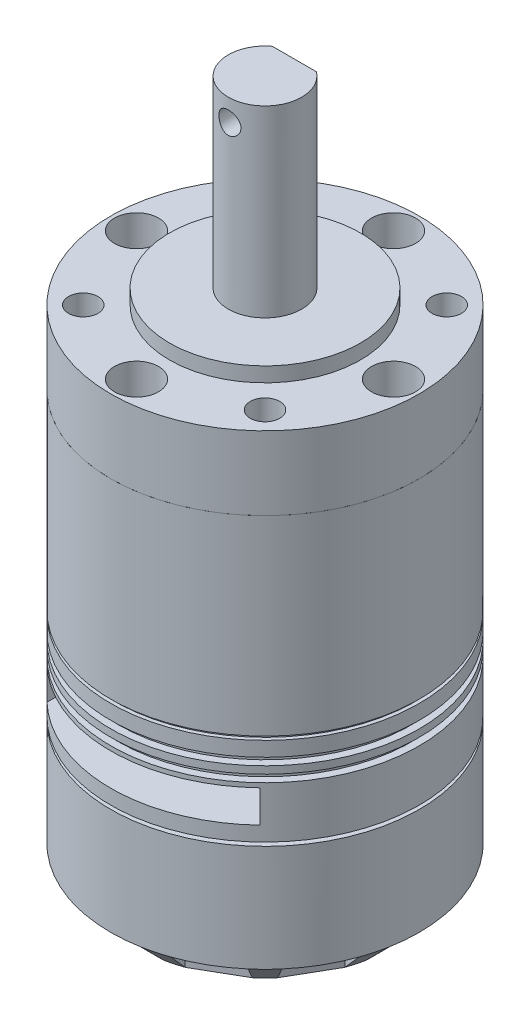
from build123d import *

# Parameters (mm, degrees)
SKETCH_1_R             = 21
EXTRUDE_1_DEPTH        = 31
CHAMFER_1_SIZE         = 3.5
CUT_EXTRUDE_1_DEPTH    = 3.5
SKETCH_3_R             = 21
EXTRUDE_2_DEPTH        = 26
SKETCH_4_R             = 21
EXTRUDE_3_DEPTH        = 10
SKETCH_5_R             = 13
EXTRUDE_4_DEPTH        = 2
SKETCH_6_R             = 5
EXTRUDE_5_DEPTH        = 25
SKETCH_7_W             = 10.482842212
SKETCH_7_H             = 3.27064677
CUT_EXTRUDE_D_DEPTH    = 20
CUT_EXTRUDE_START      = 0.5
SKETCH_8_R             = 21
SKETCH_8_R_2           = 20.5
CUT_EXTRUDE_3_DEPTH    = 0.5
CUT_EXTRUDE_START_2    = 1
SKETCH_9_R             = 21
SKETCH_9_R_2           = 20
CUT_EXTRUDE_4_DEPTH    = 1
SKETCH_10_R            = 21
SKETCH_10_R_2          = 20
CUT_EXTRUDE_5_DEPTH    = 1
SKETCH_11_R            = 21
SKETCH_11_R_2          = 20
CUT_EXTRUDE_6_DEPTH    = 0.5
SKETCH_12_W            = 29
SKETCH_12_H            = 13.007110616
CUT_EXTRUDE_7_DEPTH    = 4.4
SKETCH_13_W            = 29
SKETCH_13_H            = 4.4
CUT_EXTRUDE_8_DEPTH    = 5
SKETCH_14_R            = 3
SKETCH_14_R_2          = 2
CUT_EXTRUDE_2565_DEPTH = 8
SKETCH_15_R            = 3.5
EXTRUDE_6_DEPTH        = 5
SKETCH_16_R            = 1.5
CUT_EXTRUDE_10_DEPTH   = 5
SKETCH_17_R            = 1.5
CUT_EXTRUDE_11_DEPTH   = 10


with BuildPart() as part:
    # 草图1 → 凸台-拉伸1 (new body)
    with BuildSketch(Plane(origin=(0, 0, 0), x_dir=(1, 0, 0), z_dir=(0, 1, 0))):
        with Locations(Location((0, 0, 0), (0, 0, 270))):
            Circle(SKETCH_1_R)
    extrude(amount=EXTRUDE_1_DEPTH)

    # 倒角1
    chamfer_1_edges = [part.edges().sort_by_distance(p)[0] for p in [
        (0, 0, -21),
    ]]
    chamfer(chamfer_1_edges, length=CHAMFER_1_SIZE)

    # 草图2 → 切除-拉伸1 (cut)
    with BuildSketch(Plane.XZ):
        Polygon((3.35, -17.176364575), (-3.35, -17.176364575), (-3.85, -20.644066944), (-3.85, -22.494899201), (3.85, -22.494899201), (3.85, -20.644066944), align=None)
        Polygon((-6.987835668, -19.803286411), (-5.686997185, -16.550168066), (-11.48936739, -13.200168066), (-13.656231277, -15.953286411), (-14.581647405, -17.556154163), (-7.913251796, -21.406154163), align=None)
        Polygon((-15.953286411, -13.656231277), (-13.200168066, -11.48936739), (-16.550168066, -5.686997185), (-19.803286411, -6.987835668), (-21.406154163, -7.913251796), (-17.556154163, -14.581647405), align=None)
        Polygon((-20.644066944, -3.85), (-17.176364575, -3.35), (-17.176364575, 3.35), (-20.644066944, 3.85), (-22.494899201, 3.85), (-22.494899201, -3.85), align=None)
        Polygon((-19.803286411, 6.987835668), (-16.550168066, 5.686997185), (-13.200168066, 11.48936739), (-15.953286411, 13.656231277), (-17.556154163, 14.581647405), (-21.406154163, 7.913251796), align=None)
        Polygon((-13.656231277, 15.953286411), (-11.48936739, 13.200168066), (-5.686997185, 16.550168066), (-6.987835668, 19.803286411), (-7.913251796, 21.406154163), (-14.581647405, 17.556154163), align=None)
        Polygon((-3.85, 20.644066944), (-3.35, 17.176364575), (3.35, 17.176364575), (3.85, 20.644066944), (3.85, 22.494899201), (-3.85, 22.494899201), align=None)
        Polygon((6.987835668, 19.803286411), (5.686997185, 16.550168066), (11.48936739, 13.200168066), (13.656231277, 15.953286411), (14.581647405, 17.556154163), (7.913251796, 21.406154163), align=None)
        Polygon((15.953286411, 13.656231277), (13.200168066, 11.48936739), (16.550168066, 5.686997185), (19.803286411, 6.987835668), (21.406154163, 7.913251796), (17.556154163, 14.581647405), align=None)
        Polygon((20.644066944, 3.85), (17.176364575, 3.35), (17.176364575, -3.35), (20.644066944, -3.85), (22.494899201, -3.85), (22.494899201, 3.85), align=None)
        Polygon((19.803286411, -6.987835668), (16.550168066, -5.686997185), (13.200168066, -11.48936739), (15.953286411, -13.656231277), (17.556154163, -14.581647405), (21.406154163, -7.913251796), align=None)
        Polygon((13.656231277, -15.953286411), (11.48936739, -13.200168066), (5.686997185, -16.550168066), (6.987835668, -19.803286411), (7.913251796, -21.406154163), (14.581647405, -17.556154163), align=None)
    extrude(amount=-CUT_EXTRUDE_1_DEPTH, mode=Mode.SUBTRACT)

    # 草图8 → 切除-拉伸3 (cut)
    with BuildSketch(Plane(origin=(0, 31, 0), x_dir=(-1, 0, 0), z_dir=(0, -1, 0)).offset(CUT_EXTRUDE_START)):
        with Locations(Location((0, 0, 0), (0, 0, 270))):
            Circle(SKETCH_8_R)
        with Locations(Location((0, 0, 0), (0, 0, 90))):
            Circle(SKETCH_8_R_2, mode=Mode.SUBTRACT)
    extrude(amount=-CUT_EXTRUDE_3_DEPTH, mode=Mode.SUBTRACT)

    # 草图9 → 切除-拉伸4 (cut)
    with BuildSketch(Plane(origin=(0, 26.5, 0), x_dir=(-1, 0, 0), z_dir=(0, -1, 0)).offset(CUT_EXTRUDE_START_2)):
        with Locations(Location((0, 0, 0), (0, 0, 270))):
            Circle(SKETCH_9_R)
        with Locations(Location((0, 0, 0), (0, 0, 90))):
            Circle(SKETCH_9_R_2, mode=Mode.SUBTRACT)
    extrude(amount=-CUT_EXTRUDE_4_DEPTH, mode=Mode.SUBTRACT)

    # 草图10 → 切除-拉伸5 (cut)
    with BuildSketch(Plane(origin=(0, 27.5, 0), x_dir=(-1, 0, 0), z_dir=(0, -1, 0))):
        with Locations(Location((0, 0, 0), (0, 0, 270))):
            Circle(SKETCH_10_R)
        with Locations(Location((0, 0, 0), (0, 0, 90))):
            Circle(SKETCH_10_R_2, mode=Mode.SUBTRACT)
    extrude(amount=-CUT_EXTRUDE_5_DEPTH, mode=Mode.SUBTRACT)

    # 草图11 → 切除-拉伸6 (cut)
    with BuildSketch(Plane(origin=(0, 18, 0), x_dir=(-1, 0, 0), z_dir=(0, -1, 0))):
        with Locations(Location((0, 0, 0), (0, 0, 270))):
            Circle(SKETCH_11_R)
        with Locations(Location((0, 0, 0), (0, 0, 90))):
            Circle(SKETCH_11_R_2, mode=Mode.SUBTRACT)
    extrude(amount=-CUT_EXTRUDE_6_DEPTH, mode=Mode.SUBTRACT)

    # 草图12 → 切除-拉伸7 (cut)
    with BuildSketch(Plane(origin=(0, 24.9, 0), x_dir=(1, 0, 0), z_dir=(0, 1, 0))):
        with Locations((0, -21.694012839)):
            Rectangle(SKETCH_12_W, SKETCH_12_H)
    extrude(amount=-CUT_EXTRUDE_7_DEPTH, mode=Mode.SUBTRACT)

    # 草图13 → 切除-拉伸8 (cut)
    with BuildSketch(Plane.XY.offset(15.190457531)):
        with Locations((0, 22.7)):
            Rectangle(SKETCH_13_W, SKETCH_13_H)
    extrude(amount=-CUT_EXTRUDE_8_DEPTH, mode=Mode.SUBTRACT)

    # 草图15 → 凸台-拉伸6 (add)
    with BuildSketch(Plane.XZ):
        with Locations(Location((0, 0, 0), (0, 0, 90))):
            Circle(SKETCH_15_R)
    extrude(amount=EXTRUDE_6_DEPTH)

    # 草图16 → 切除-拉伸10 (cut)
    with BuildSketch(Plane.XZ):
        with Locations(Location((-6.75, 0, 0), (0, 0, 270))):
            Circle(SKETCH_16_R)
        with Locations(Location((6.75, 0, 0), (0, 0, 270))):
            Circle(SKETCH_16_R)
    extrude(amount=-CUT_EXTRUDE_10_DEPTH, mode=Mode.SUBTRACT)


with BuildPart() as body_2:
    # 草图3 → 凸台-拉伸2 (new body)
    with BuildSketch(Plane(origin=(0, 31, 0), x_dir=(1, 0, 0), z_dir=(0, 1, 0))):
        with Locations(Location((0, 0, 0), (0, 0, 90))):
            Circle(SKETCH_3_R)
    extrude(amount=EXTRUDE_2_DEPTH)


with BuildPart() as body_3:
    # 草图4 → 凸台-拉伸3 (new body)
    with BuildSketch(Plane(origin=(0, 57, 0), x_dir=(1, 0, 0), z_dir=(0, 1, 0))):
        with Locations(Location((0, 0, 0), (0, 0, 270))):
            Circle(SKETCH_4_R)
    extrude(amount=EXTRUDE_3_DEPTH)

    # 草图5 → 凸台-拉伸4 (add)
    with BuildSketch(Plane(origin=(0, 67, 0), x_dir=(1, 0, 0), z_dir=(0, 1, 0))):
        with Locations(Location((0, 0, 0), (0, 0, 270))):
            Circle(SKETCH_5_R)
    extrude(amount=EXTRUDE_4_DEPTH)

    # 草图6 → 凸台-拉伸5 (add)
    with BuildSketch(Plane(origin=(0, 69, 0), x_dir=(1, 0, 0), z_dir=(0, 1, 0))):
        with Locations(Location((0, 0, 0), (0, 0, 270))):
            Circle(SKETCH_6_R)
    extrude(amount=EXTRUDE_5_DEPTH)

    # 草图7 → D形面 (cut)
    with BuildSketch(Plane(origin=(0, 94, 0), x_dir=(1, 0, 0), z_dir=(0, 1, 0))):
        with Locations((-0.041931369, 5.635323385)):
            Rectangle(SKETCH_7_W, SKETCH_7_H)
    extrude(amount=-CUT_EXTRUDE_D_DEPTH, mode=Mode.SUBTRACT)

    # 草图14 → Cut-Extrude 2565 (cut)
    with BuildSketch(Plane(origin=(0, 67, 0), x_dir=(1, 0, 0), z_dir=(0, 1, 0))):
        with Locations(Location((0, 17.5, 0), (0, 0, 270))):
            Circle(SKETCH_14_R)
        with Locations(Location((-17.5, 0, 0), (0, 0, 270))):
            Circle(SKETCH_14_R)
        with Locations(Location((0, -17.5, 0), (0, 0, 270))):
            Circle(SKETCH_14_R)
        with Locations(Location((17.5, 0, 0), (0, 0, 270))):
            Circle(SKETCH_14_R)
        with Locations(Location((12.374368671, 12.374368671, 0), (0, 0, 270))):
            Circle(SKETCH_14_R_2)
        with Locations(Location((12.374368671, -12.374368671, 0), (0, 0, 270))):
            Circle(SKETCH_14_R_2)
        with Locations(Location((-12.374368671, -12.374368671, 0), (0, 0, 270))):
            Circle(SKETCH_14_R_2)
        with Locations(Location((-12.374368671, 12.374368671, 0), (0, 0, 270))):
            Circle(SKETCH_14_R_2)
    extrude(amount=-CUT_EXTRUDE_2565_DEPTH, mode=Mode.SUBTRACT)

    # 草图17 → 切除-拉伸11 (cut)
    with BuildSketch(Plane(origin=(0, 0, -4), x_dir=(-1, 0, 0), z_dir=(0, 0, -1))):
        with Locations((0, 91)):
            Circle(SKETCH_17_R)
    extrude(amount=-CUT_EXTRUDE_11_DEPTH, mode=Mode.SUBTRACT)


solid = Compound([part.part, body_2.part, body_3.part])
